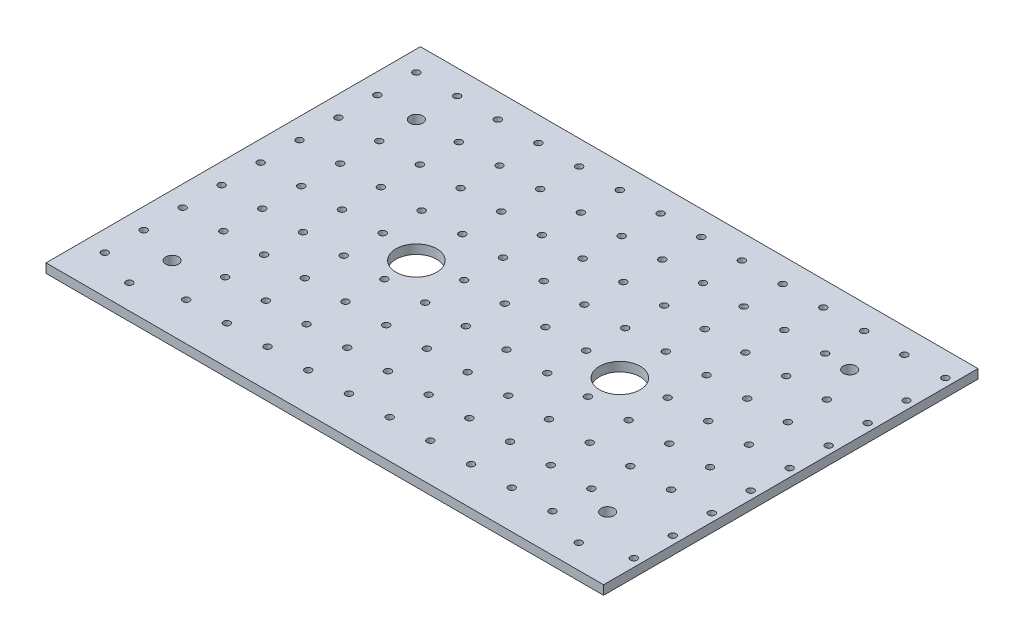
from build123d import *

# Parameters (mm, degrees)
SKETCH2_W           = 274
SKETCH2_H           = 184
SKETCH2_R           = 1.65
SKETCH2_R_2         = 3.15
SKETCH2_R_3         = 10
BOSS_EXTRUDE1_DEPTH = 2.25


with BuildPart() as part:
    # Sketch2 → Boss-Extrude1 (new, symmetric)
    with BuildSketch(Plane(origin=(0, 0, 0), x_dir=(1, 0, 0), z_dir=(0, 1, 0))):
        Rectangle(SKETCH2_W, SKETCH2_H)
        with Locations(Location((-127, 80, 0), (0, 0, 270))):
            Circle(SKETCH2_R, mode=Mode.SUBTRACT)
        with Locations(Location((-87, 80, 0), (0, 0, 270))):
            Circle(SKETCH2_R, mode=Mode.SUBTRACT)
        with Locations(Location((-67, 80, 0), (0, 0, 270))):
            Circle(SKETCH2_R, mode=Mode.SUBTRACT)
        with Locations(Location((-47, 80, 0), (0, 0, 270))):
            Circle(SKETCH2_R, mode=Mode.SUBTRACT)
        with Locations(Location((-27, 80, 0), (0, 0, 270))):
            Circle(SKETCH2_R, mode=Mode.SUBTRACT)
        with Locations(Location((-7, 80, 0), (0, 0, 270))):
            Circle(SKETCH2_R, mode=Mode.SUBTRACT)
        with Locations(Location((13, 80, 0), (0, 0, 270))):
            Circle(SKETCH2_R, mode=Mode.SUBTRACT)
        with Locations(Location((33, 80, 0), (0, 0, 270))):
            Circle(SKETCH2_R, mode=Mode.SUBTRACT)
        with Locations(Location((53, 80, 0), (0, 0, 270))):
            Circle(SKETCH2_R, mode=Mode.SUBTRACT)
        with Locations(Location((73, 80, 0), (0, 0, 270))):
            Circle(SKETCH2_R, mode=Mode.SUBTRACT)
        with Locations(Location((93, 80, 0), (0, 0, 270))):
            Circle(SKETCH2_R, mode=Mode.SUBTRACT)
        with Locations(Location((133, 80, 0), (0, 0, 270))):
            Circle(SKETCH2_R, mode=Mode.SUBTRACT)
        with Locations(Location((-86.985439467, 60.845424751, 0), (0, 0, 270))):
            Circle(SKETCH2_R, mode=Mode.SUBTRACT)
        with Locations(Location((-66.985439467, 60.845424751, 0), (0, 0, 270))):
            Circle(SKETCH2_R, mode=Mode.SUBTRACT)
        with Locations(Location((-46.985439467, 60.845424751, 0), (0, 0, 270))):
            Circle(SKETCH2_R, mode=Mode.SUBTRACT)
        with Locations(Location((-26.985439467, 60.845424751, 0), (0, 0, 270))):
            Circle(SKETCH2_R, mode=Mode.SUBTRACT)
        with Locations(Location((-6.985439467, 60.845424751, 0), (0, 0, 270))):
            Circle(SKETCH2_R, mode=Mode.SUBTRACT)
        with Locations(Location((13.014560533, 60.845424751, 0), (0, 0, 270))):
            Circle(SKETCH2_R, mode=Mode.SUBTRACT)
        with Locations(Location((33.014560533, 60.845424751, 0), (0, 0, 270))):
            Circle(SKETCH2_R, mode=Mode.SUBTRACT)
        with Locations(Location((53.014560533, 60.845424751, 0), (0, 0, 270))):
            Circle(SKETCH2_R, mode=Mode.SUBTRACT)
        with Locations(Location((73.014560533, 60.845424751, 0), (0, 0, 270))):
            Circle(SKETCH2_R, mode=Mode.SUBTRACT)
        with Locations(Location((93.014560533, 60.845424751, 0), (0, 0, 270))):
            Circle(SKETCH2_R, mode=Mode.SUBTRACT)
        with Locations(Location((133.014560533, 60.845424751, 0), (0, 0, 270))):
            Circle(SKETCH2_R, mode=Mode.SUBTRACT)
        with Locations(Location((-106.970878935, 41.690849501, 0), (0, 0, 270))):
            Circle(SKETCH2_R, mode=Mode.SUBTRACT)
        with Locations(Location((-86.970878935, 41.690849501, 0), (0, 0, 270))):
            Circle(SKETCH2_R, mode=Mode.SUBTRACT)
        with Locations(Location((-66.970878935, 41.690849501, 0), (0, 0, 270))):
            Circle(SKETCH2_R, mode=Mode.SUBTRACT)
        with Locations(Location((-46.970878935, 41.690849501, 0), (0, 0, 270))):
            Circle(SKETCH2_R, mode=Mode.SUBTRACT)
        with Locations(Location((-26.970878935, 41.690849501, 0), (0, 0, 270))):
            Circle(SKETCH2_R, mode=Mode.SUBTRACT)
        with Locations(Location((-6.970878935, 41.690849501, 0), (0, 0, 270))):
            Circle(SKETCH2_R, mode=Mode.SUBTRACT)
        with Locations(Location((13.029121065, 41.690849501, 0), (0, 0, 270))):
            Circle(SKETCH2_R, mode=Mode.SUBTRACT)
        with Locations(Location((33.029121065, 41.690849501, 0), (0, 0, 270))):
            Circle(SKETCH2_R, mode=Mode.SUBTRACT)
        with Locations(Location((53.029121065, 41.690849501, 0), (0, 0, 270))):
            Circle(SKETCH2_R, mode=Mode.SUBTRACT)
        with Locations(Location((73.029121065, 41.690849501, 0), (0, 0, 270))):
            Circle(SKETCH2_R, mode=Mode.SUBTRACT)
        with Locations(Location((93.029121065, 41.690849501, 0), (0, 0, 270))):
            Circle(SKETCH2_R, mode=Mode.SUBTRACT)
        with Locations(Location((113.029121065, 41.690849501, 0), (0, 0, 270))):
            Circle(SKETCH2_R, mode=Mode.SUBTRACT)
        with Locations(Location((133.029121065, 41.690849501, 0), (0, 0, 270))):
            Circle(SKETCH2_R, mode=Mode.SUBTRACT)
        with Locations(Location((-106.956318402, 22.536274252, 0), (0, 0, 270))):
            Circle(SKETCH2_R, mode=Mode.SUBTRACT)
        with Locations(Location((-86.956318402, 22.536274252, 0), (0, 0, 270))):
            Circle(SKETCH2_R, mode=Mode.SUBTRACT)
        with Locations(Location((-66.956318402, 22.536274252, 0), (0, 0, 270))):
            Circle(SKETCH2_R, mode=Mode.SUBTRACT)
        with Locations(Location((-46.956318402, 22.536274252, 0), (0, 0, 270))):
            Circle(SKETCH2_R, mode=Mode.SUBTRACT)
        with Locations(Location((-26.956318402, 22.536274252, 0), (0, 0, 270))):
            Circle(SKETCH2_R, mode=Mode.SUBTRACT)
        with Locations(Location((-6.956318402, 22.536274252, 0), (0, 0, 270))):
            Circle(SKETCH2_R, mode=Mode.SUBTRACT)
        with Locations(Location((13.043681598, 22.536274252, 0), (0, 0, 270))):
            Circle(SKETCH2_R, mode=Mode.SUBTRACT)
        with Locations(Location((33.043681598, 22.536274252, 0), (0, 0, 270))):
            Circle(SKETCH2_R, mode=Mode.SUBTRACT)
        with Locations(Location((53.043681598, 22.536274252, 0), (0, 0, 270))):
            Circle(SKETCH2_R, mode=Mode.SUBTRACT)
        with Locations(Location((73.043681598, 22.536274252, 0), (0, 0, 270))):
            Circle(SKETCH2_R, mode=Mode.SUBTRACT)
        with Locations(Location((93.043681598, 22.536274252, 0), (0, 0, 270))):
            Circle(SKETCH2_R, mode=Mode.SUBTRACT)
        with Locations(Location((113.043681598, 22.536274252, 0), (0, 0, 270))):
            Circle(SKETCH2_R, mode=Mode.SUBTRACT)
        with Locations(Location((133.043681598, 22.536274252, 0), (0, 0, 270))):
            Circle(SKETCH2_R, mode=Mode.SUBTRACT)
        with Locations(Location((-106.94175787, 3.381699003, 0), (0, 0, 270))):
            Circle(SKETCH2_R, mode=Mode.SUBTRACT)
        with Locations(Location((-86.94175787, 3.381699003, 0), (0, 0, 270))):
            Circle(SKETCH2_R, mode=Mode.SUBTRACT)
        with Locations(Location((-66.94175787, 3.381699003, 0), (0, 0, 270))):
            Circle(SKETCH2_R, mode=Mode.SUBTRACT)
        with Locations(Location((-26.94175787, 3.381699003, 0), (0, 0, 270))):
            Circle(SKETCH2_R, mode=Mode.SUBTRACT)
        with Locations(Location((-6.94175787, 3.381699003, 0), (0, 0, 270))):
            Circle(SKETCH2_R, mode=Mode.SUBTRACT)
        with Locations(Location((13.05824213, 3.381699003, 0), (0, 0, 270))):
            Circle(SKETCH2_R, mode=Mode.SUBTRACT)
        with Locations(Location((33.05824213, 3.381699003, 0), (0, 0, 270))):
            Circle(SKETCH2_R, mode=Mode.SUBTRACT)
        with Locations(Location((73.05824213, 3.381699003, 0), (0, 0, 270))):
            Circle(SKETCH2_R, mode=Mode.SUBTRACT)
        with Locations(Location((93.05824213, 3.381699003, 0), (0, 0, 270))):
            Circle(SKETCH2_R, mode=Mode.SUBTRACT)
        with Locations(Location((113.05824213, 3.381699003, 0), (0, 0, 270))):
            Circle(SKETCH2_R, mode=Mode.SUBTRACT)
        with Locations(Location((133.05824213, 3.381699003, 0), (0, 0, 270))):
            Circle(SKETCH2_R, mode=Mode.SUBTRACT)
        with Locations(Location((-106.927197337, -15.772876247, 0), (0, 0, 270))):
            Circle(SKETCH2_R, mode=Mode.SUBTRACT)
        with Locations(Location((-86.927197337, -15.772876247, 0), (0, 0, 270))):
            Circle(SKETCH2_R, mode=Mode.SUBTRACT)
        with Locations(Location((-66.927197337, -15.772876247, 0), (0, 0, 270))):
            Circle(SKETCH2_R, mode=Mode.SUBTRACT)
        with Locations(Location((-46.927197337, -15.772876247, 0), (0, 0, 270))):
            Circle(SKETCH2_R, mode=Mode.SUBTRACT)
        with Locations(Location((-26.927197337, -15.772876247, 0), (0, 0, 270))):
            Circle(SKETCH2_R, mode=Mode.SUBTRACT)
        with Locations(Location((-6.927197337, -15.772876247, 0), (0, 0, 270))):
            Circle(SKETCH2_R, mode=Mode.SUBTRACT)
        with Locations(Location((13.072802663, -15.772876247, 0), (0, 0, 270))):
            Circle(SKETCH2_R, mode=Mode.SUBTRACT)
        with Locations(Location((33.072802663, -15.772876247, 0), (0, 0, 270))):
            Circle(SKETCH2_R, mode=Mode.SUBTRACT)
        with Locations(Location((53.072802663, -15.772876247, 0), (0, 0, 270))):
            Circle(SKETCH2_R, mode=Mode.SUBTRACT)
        with Locations(Location((73.072802663, -15.772876247, 0), (0, 0, 270))):
            Circle(SKETCH2_R, mode=Mode.SUBTRACT)
        with Locations(Location((93.072802663, -15.772876247, 0), (0, 0, 270))):
            Circle(SKETCH2_R, mode=Mode.SUBTRACT)
        with Locations(Location((113.072802663, -15.772876247, 0), (0, 0, 270))):
            Circle(SKETCH2_R, mode=Mode.SUBTRACT)
        with Locations(Location((133.072802663, -15.772876247, 0), (0, 0, 270))):
            Circle(SKETCH2_R, mode=Mode.SUBTRACT)
        with Locations(Location((-106.912636804, -34.927451496, 0), (0, 0, 270))):
            Circle(SKETCH2_R, mode=Mode.SUBTRACT)
        with Locations(Location((-86.912636804, -34.927451496, 0), (0, 0, 270))):
            Circle(SKETCH2_R, mode=Mode.SUBTRACT)
        with Locations(Location((-66.912636804, -34.927451496, 0), (0, 0, 270))):
            Circle(SKETCH2_R, mode=Mode.SUBTRACT)
        with Locations(Location((-46.912636804, -34.927451496, 0), (0, 0, 270))):
            Circle(SKETCH2_R, mode=Mode.SUBTRACT)
        with Locations(Location((-26.912636804, -34.927451496, 0), (0, 0, 270))):
            Circle(SKETCH2_R, mode=Mode.SUBTRACT)
        with Locations(Location((-6.912636804, -34.927451496, 0), (0, 0, 270))):
            Circle(SKETCH2_R, mode=Mode.SUBTRACT)
        with Locations(Location((13.087363196, -34.927451496, 0), (0, 0, 270))):
            Circle(SKETCH2_R, mode=Mode.SUBTRACT)
        with Locations(Location((33.087363196, -34.927451496, 0), (0, 0, 270))):
            Circle(SKETCH2_R, mode=Mode.SUBTRACT)
        with Locations(Location((53.087363196, -34.927451496, 0), (0, 0, 270))):
            Circle(SKETCH2_R, mode=Mode.SUBTRACT)
        with Locations(Location((73.087363196, -34.927451496, 0), (0, 0, 270))):
            Circle(SKETCH2_R, mode=Mode.SUBTRACT)
        with Locations(Location((93.087363196, -34.927451496, 0), (0, 0, 270))):
            Circle(SKETCH2_R, mode=Mode.SUBTRACT)
        with Locations(Location((113.087363196, -34.927451496, 0), (0, 0, 270))):
            Circle(SKETCH2_R, mode=Mode.SUBTRACT)
        with Locations(Location((133.087363196, -34.927451496, 0), (0, 0, 270))):
            Circle(SKETCH2_R, mode=Mode.SUBTRACT)
        with Locations(Location((-86.898076272, -54.082026745, 0), (0, 0, 270))):
            Circle(SKETCH2_R, mode=Mode.SUBTRACT)
        with Locations(Location((-66.898076272, -54.082026745, 0), (0, 0, 270))):
            Circle(SKETCH2_R, mode=Mode.SUBTRACT)
        with Locations(Location((-46.898076272, -54.082026745, 0), (0, 0, 270))):
            Circle(SKETCH2_R, mode=Mode.SUBTRACT)
        with Locations(Location((-26.898076272, -54.082026745, 0), (0, 0, 270))):
            Circle(SKETCH2_R, mode=Mode.SUBTRACT)
        with Locations(Location((-6.898076272, -54.082026745, 0), (0, 0, 270))):
            Circle(SKETCH2_R, mode=Mode.SUBTRACT)
        with Locations(Location((13.101923728, -54.082026745, 0), (0, 0, 270))):
            Circle(SKETCH2_R, mode=Mode.SUBTRACT)
        with Locations(Location((33.101923728, -54.082026745, 0), (0, 0, 270))):
            Circle(SKETCH2_R, mode=Mode.SUBTRACT)
        with Locations(Location((53.101923728, -54.082026745, 0), (0, 0, 270))):
            Circle(SKETCH2_R, mode=Mode.SUBTRACT)
        with Locations(Location((73.101923728, -54.082026745, 0), (0, 0, 270))):
            Circle(SKETCH2_R, mode=Mode.SUBTRACT)
        with Locations(Location((93.101923728, -54.082026745, 0), (0, 0, 270))):
            Circle(SKETCH2_R, mode=Mode.SUBTRACT)
        with Locations(Location((133.101923728, -54.082026745, 0), (0, 0, 270))):
            Circle(SKETCH2_R, mode=Mode.SUBTRACT)
        with Locations(Location((-86.883515739, -73.236601995, 0), (0, 0, 270))):
            Circle(SKETCH2_R, mode=Mode.SUBTRACT)
        with Locations(Location((-66.883515739, -73.236601995, 0), (0, 0, 270))):
            Circle(SKETCH2_R, mode=Mode.SUBTRACT)
        with Locations(Location((-46.883515739, -73.236601995, 0), (0, 0, 270))):
            Circle(SKETCH2_R, mode=Mode.SUBTRACT)
        with Locations(Location((-26.883515739, -73.236601995, 0), (0, 0, 270))):
            Circle(SKETCH2_R, mode=Mode.SUBTRACT)
        with Locations(Location((-6.883515739, -73.236601995, 0), (0, 0, 270))):
            Circle(SKETCH2_R, mode=Mode.SUBTRACT)
        with Locations(Location((13.116484261, -73.236601995, 0), (0, 0, 270))):
            Circle(SKETCH2_R, mode=Mode.SUBTRACT)
        with Locations(Location((33.116484261, -73.236601995, 0), (0, 0, 270))):
            Circle(SKETCH2_R, mode=Mode.SUBTRACT)
        with Locations(Location((53.116484261, -73.236601995, 0), (0, 0, 270))):
            Circle(SKETCH2_R, mode=Mode.SUBTRACT)
        with Locations(Location((73.116484261, -73.236601995, 0), (0, 0, 270))):
            Circle(SKETCH2_R, mode=Mode.SUBTRACT)
        with Locations(Location((93.116484261, -73.236601995, 0), (0, 0, 270))):
            Circle(SKETCH2_R, mode=Mode.SUBTRACT)
        with Locations(Location((133.116484261, -73.236601995, 0), (0, 0, 270))):
            Circle(SKETCH2_R, mode=Mode.SUBTRACT)
        with Locations(Location((-126.985439467, 60.845424751, 0), (0, 0, 270))):
            Circle(SKETCH2_R, mode=Mode.SUBTRACT)
        with Locations(Location((-126.970878935, 41.690849501, 0), (0, 0, 270))):
            Circle(SKETCH2_R, mode=Mode.SUBTRACT)
        with Locations(Location((-126.956318402, 22.536274252, 0), (0, 0, 270))):
            Circle(SKETCH2_R, mode=Mode.SUBTRACT)
        with Locations(Location((-126.94175787, 3.381699003, 0), (0, 0, 270))):
            Circle(SKETCH2_R, mode=Mode.SUBTRACT)
        with Locations(Location((-126.927197337, -15.772876247, 0), (0, 0, 270))):
            Circle(SKETCH2_R, mode=Mode.SUBTRACT)
        with Locations(Location((-126.912636804, -34.927451496, 0), (0, 0, 270))):
            Circle(SKETCH2_R, mode=Mode.SUBTRACT)
        with Locations(Location((-126.898076272, -54.082026745, 0), (0, 0, 270))):
            Circle(SKETCH2_R, mode=Mode.SUBTRACT)
        with Locations(Location((-126.883515739, -73.236601995, 0), (0, 0, 270))):
            Circle(SKETCH2_R, mode=Mode.SUBTRACT)
        with Locations(Location((-107, 60, 0), (0, 0, 270))):
            Circle(SKETCH2_R_2, mode=Mode.SUBTRACT)
        with Locations(Location((-107, -60, 0), (0, 0, 270))):
            Circle(SKETCH2_R_2, mode=Mode.SUBTRACT)
        with Locations(Location((107, -60, 0), (0, 0, 270))):
            Circle(SKETCH2_R_2, mode=Mode.SUBTRACT)
        with Locations(Location((105.938185762, 60, 0), (0, 0, 270))):
            Circle(SKETCH2_R_2, mode=Mode.SUBTRACT)
        with Locations(Location((53, 0, 0), (0, 0, 270))):
            Circle(SKETCH2_R_3, mode=Mode.SUBTRACT)
        with Locations(Location((-47, 0, 0), (0, 0, 270))):
            Circle(SKETCH2_R_3, mode=Mode.SUBTRACT)
        with Locations(Location((113, -80.192235068, 0), (0, 0, 270))):
            Circle(SKETCH2_R, mode=Mode.SUBTRACT)
        with Locations(Location((113, 79.807764932, 0), (0, 0, 270))):
            Circle(SKETCH2_R, mode=Mode.SUBTRACT)
        with Locations(Location((-108.061814238, -80, 0), (0, 0, 270))):
            Circle(SKETCH2_R, mode=Mode.SUBTRACT)
        with Locations(Location((-107, 80, 0), (0, 0, 270))):
            Circle(SKETCH2_R, mode=Mode.SUBTRACT)
    extrude(amount=BOSS_EXTRUDE1_DEPTH, both=True)


solid = part.part
